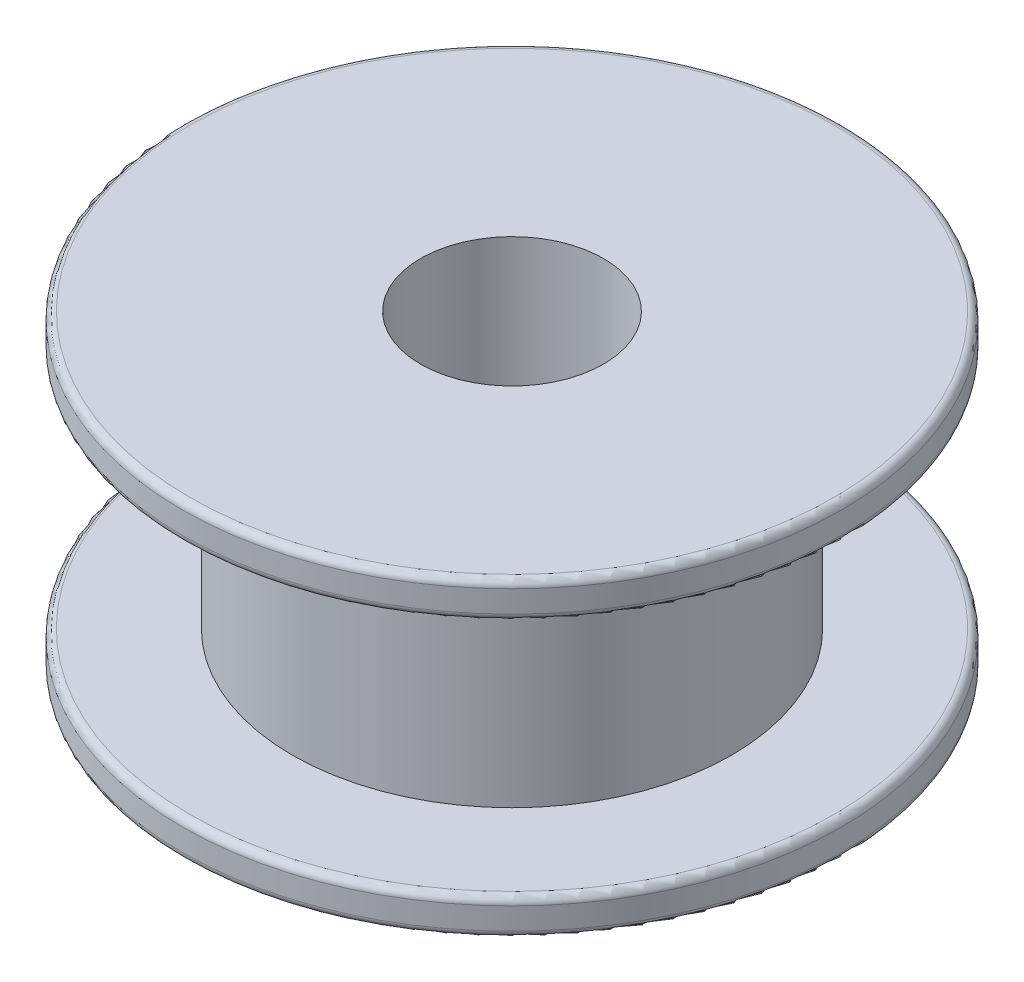
from build123d import *

# Parameters (mm, degrees)
SKETCH1_R           = 9
BOSS_EXTRUDE1_DEPTH = 1
SKETCH2_R           = 6
BOSS_EXTRUDE2_DEPTH = 6.5
SKETCH3_R           = 9
BOSS_EXTRUDE3_DEPTH = 1
SKETCH4_R           = 2.5
CUT_EXTRUDE1_DEPTH  = 16.305227865
FILLET1_R           = 0.2


with BuildPart() as part:
    # Sketch1 → Boss-Extrude1 (new body)
    with BuildSketch(Plane(origin=(0, 0, 0), x_dir=(1, 0, 0), z_dir=(0, 1, 0))):
        with Locations(Location((0, 0, 0), (0, 0, 270))):
            Circle(SKETCH1_R)
    extrude(amount=BOSS_EXTRUDE1_DEPTH)

    # Sketch2 → Boss-Extrude2 (add)
    with BuildSketch(Plane(origin=(0, 1, 0), x_dir=(1, 0, 0), z_dir=(0, 1, 0))):
        with Locations(Location((0, 0, 0), (0, 0, 90))):
            Circle(SKETCH2_R)
    extrude(amount=BOSS_EXTRUDE2_DEPTH)

    # Sketch3 → Boss-Extrude3 (add)
    with BuildSketch(Plane(origin=(0, 7.5, 0), x_dir=(1, 0, 0), z_dir=(0, 1, 0))):
        with Locations(Location((0, 0, 0), (0, 0, 270))):
            Circle(SKETCH3_R)
    extrude(amount=BOSS_EXTRUDE3_DEPTH)

    # Sketch4 → Cut-Extrude1 (cut, through all)
    with BuildSketch(Plane(origin=(0, 8.5, 0), x_dir=(1, 0, 0), z_dir=(0, 1, 0))):
        with Locations(Location((0, 0, 0), (0, 0, 270))):
            Circle(SKETCH4_R)
    extrude(amount=-CUT_EXTRUDE1_DEPTH, mode=Mode.SUBTRACT)

    # Fillet1
    fillet1_edges = [part.edges().sort_by_distance(p)[0] for p in [
        (0, 8.5, -9),
        (0, 0, -9),
        (0, 1, -9),
        (0, 7.5, -9),
    ]]
    fillet(fillet1_edges, radius=FILLET1_R)


solid = part.part
